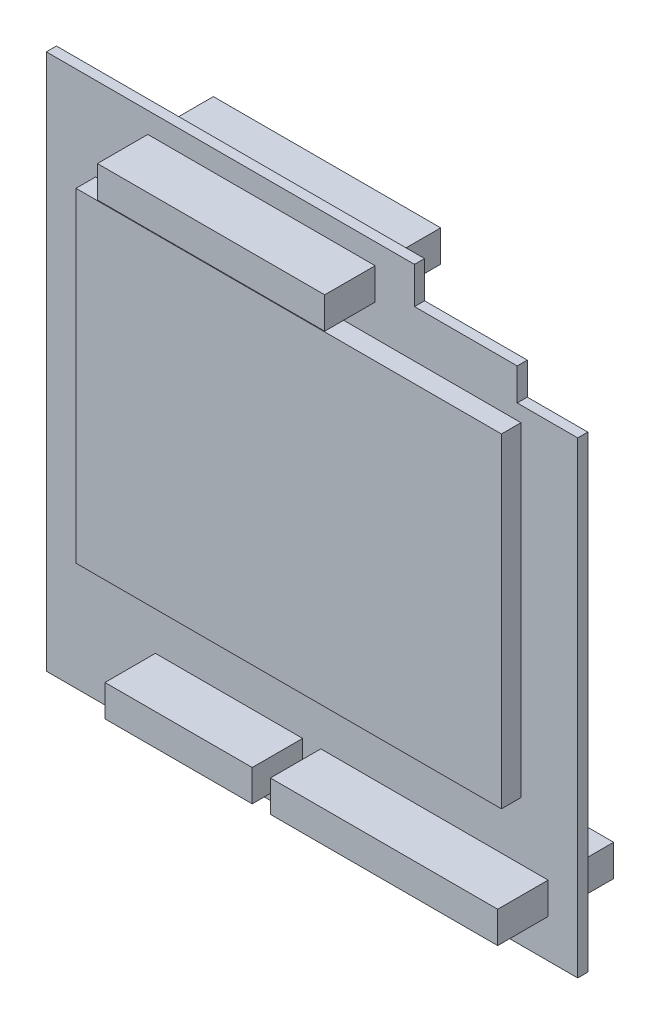
from build123d import *

# Parameters (mm, degrees)
SKETCH1_W                = 84.3
SKETCH1_H                = 85.09
BOSS_EXTRUDE1_DEPTH      = 1.6
SKETCH2_W                = 67.5
SKETCH2_H                = 51.5
BOSS_EXTRUDE2_DEPTH      = 3.1
CUT_EXTRUDE1_DEPTH       = 120.818229414
BOSS_EXTRUDE3_DEPTH      = 8
BOSS_EXTRUDE3_DEPTH_BACK = 10.4
SKETCH4_W                = 23.36
SKETCH4_H                = 5
SKETCH4_W_2              = 36.06


with BuildPart() as part:
    # Sketch1 → Boss-Extrude1 (new body)
    with BuildSketch(Plane.XY):
        with Locations((42.15, -42.545)):
            Rectangle(SKETCH1_W, SKETCH1_H)
    extrude(amount=BOSS_EXTRUDE1_DEPTH)

    # Sketch2 → Boss-Extrude2 (add)
    with BuildSketch(Plane.XY.offset(1.6)):
        with Locations((41.55, -39.05)):
            Rectangle(SKETCH2_W, SKETCH2_H)
    extrude(amount=BOSS_EXTRUDE2_DEPTH)

    # Sketch3 → Cut-Extrude1 (cut, through all)
    with BuildSketch(Plane.XY.offset(1.6)):
        Polygon((84.3, 0), (58.4, 0), (58.4, -5.8), (74.7, -5.8), (74.7, -10.89), (84.3, -10.89), align=None)
    extrude(amount=-CUT_EXTRUDE1_DEPTH, mode=Mode.SUBTRACT)

    # Sketch4 → Boss-Extrude3 (add, two sides: drawn at the far end of the back side and taken through both)
    with BuildSketch(Plane.XY.offset(1.6).offset(-BOSS_EXTRUDE3_DEPTH_BACK)):
        with Locations((28.98, -76.49)):
            Rectangle(SKETCH4_W, SKETCH4_H)
        with Locations((61.57, -76.49)):
            Rectangle(SKETCH4_W_2, SKETCH4_H)
        with Locations((34.13, -5.8)):
            Rectangle(SKETCH4_W_2, SKETCH4_H)
    extrude(amount=BOSS_EXTRUDE3_DEPTH + BOSS_EXTRUDE3_DEPTH_BACK)


solid = part.part
